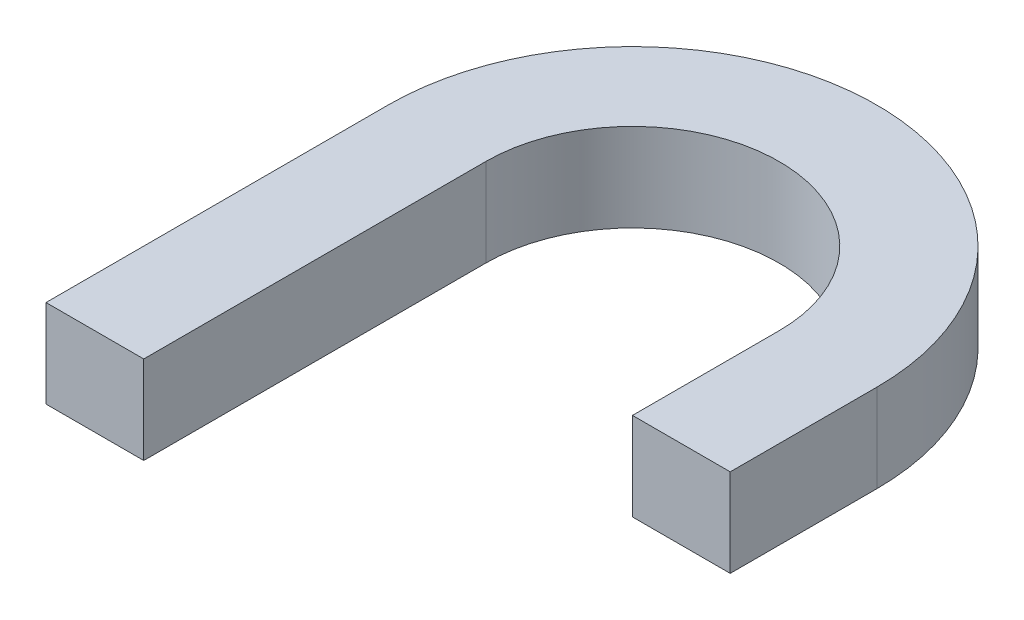
from build123d import *

# Parameters (mm, degrees)
BOSS_EXTRUDE1_DEPTH = 11.43


with BuildPart() as part:
    # Sketch1 → Boss-Extrude1 (new, symmetric)
    with BuildSketch(Plane(origin=(0, 0, 0), x_dir=(1, 0, 0), z_dir=(0, 1, 0))):
        with BuildLine():
            Line((-63.5, 0), (-63.5, -88.9))
            Line((-63.5, -88.9), (-38.1, -88.9))
            Line((-38.1, -88.9), (-38.1, 0))
            ThreePointArc((-38.1, 0), (0, 38.1), (38.1, 0))
            Line((38.1, 0), (38.1, -38.1))
            Line((38.1, -38.1), (63.5, -38.1))
            Line((63.5, -38.1), (63.5, 0))
            ThreePointArc((63.5, 0), (0, 63.5), (-63.5, 0))
        make_face()
    extrude(amount=BOSS_EXTRUDE1_DEPTH, both=True)


solid = part.part
